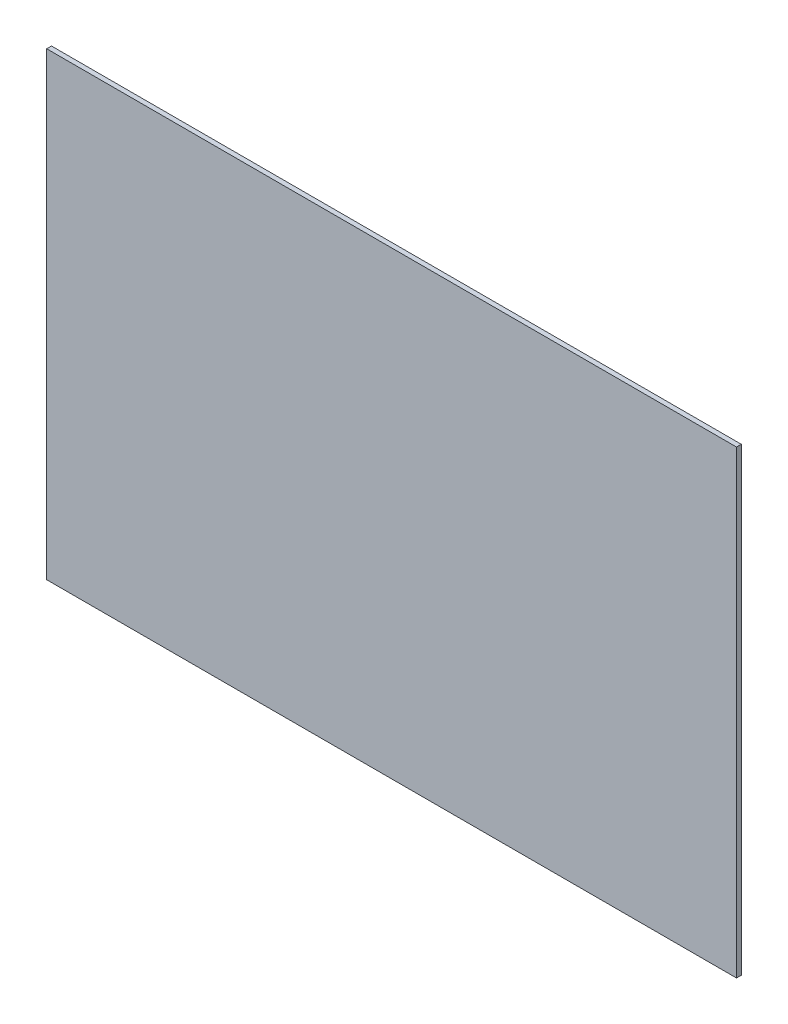
from build123d import *

# Parameters (mm, degrees)
SKETCH2_W           = 914.4
SKETCH2_H           = 609.6
BOSS_EXTRUDE1_DEPTH = 6.35


with BuildPart() as part:
    # Sketch2 → Boss-Extrude1 (new body)
    with BuildSketch(Plane.XY):
        Rectangle(SKETCH2_W, SKETCH2_H)
    extrude(amount=BOSS_EXTRUDE1_DEPTH)


solid = part.part
